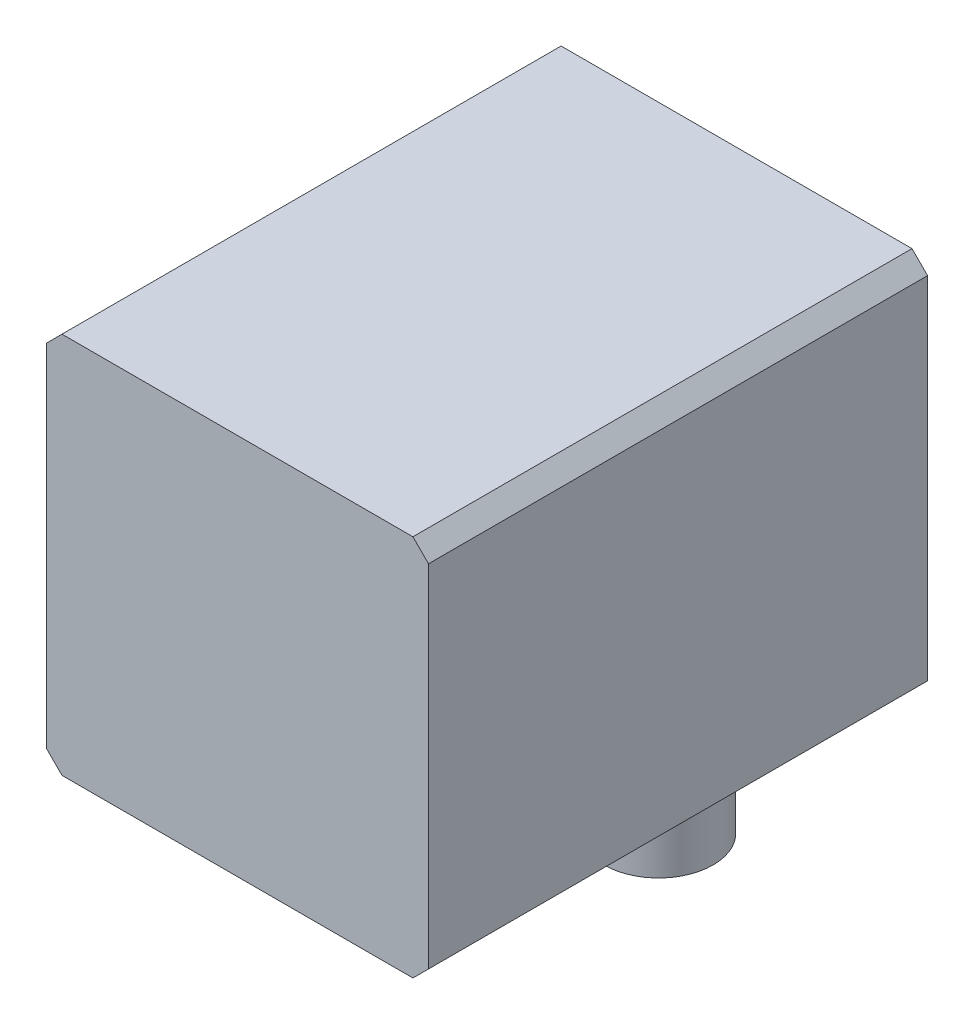
from build123d import *

# Parameters (mm, degrees)
SKETCH_6_W          = 122.5
SKETCH_6_H          = 122.5
EXTRUDE_5_DEPTH     = 160
SKETCH_7_R          = 17.5
EXTRUDE_6_DEPTH     = 55.5
SKETCH_8_R          = 6
EXTRUDE_7_DEPTH     = 5
CHAMFER_1_SIZE      = 5
SKETCH_9_R          = 2.75
CUT_EXTRUDE_1_DEPTH = 20


with BuildPart() as part:
    # 草图6 → 凸台-拉伸5 (new body)
    with BuildSketch(Plane.XY):
        Rectangle(SKETCH_6_W, SKETCH_6_H)
    extrude(amount=EXTRUDE_5_DEPTH)

    # 草图7 → 凸台-拉伸6 (add)
    with BuildSketch(Plane.XZ.offset(61.25)):
        with Locations(Location((0, 25, 0), (0, 0, 90))):
            Circle(SKETCH_7_R)
    extrude(amount=EXTRUDE_6_DEPTH)

    # 草图8 → 凸台-拉伸7 (add)
    with BuildSketch(Plane.XZ.offset(116.75)):
        with Locations(Location((0, 25, 0), (0, 0, 270))):
            Circle(SKETCH_8_R)
    extrude(amount=EXTRUDE_7_DEPTH)

    # 倒角1
    chamfer_1_edges = [part.edges().sort_by_distance(p)[0] for p in [
        (-61.25, 61.25, 80),
        (61.25, 61.25, 80),
        (61.25, -61.25, 80),
        (-61.25, -61.25, 80),
    ]]
    chamfer(chamfer_1_edges, length=CHAMFER_1_SIZE)

    # 草图9 → 切除-拉伸1 (cut)
    with BuildSketch(Plane(origin=(0, 0, 0), x_dir=(-1, 0, 0), z_dir=(0, 0, -1))):
        with Locations((-48, 48)):
            Circle(SKETCH_9_R)
        with Locations((48, 48)):
            Circle(SKETCH_9_R)
        with Locations((48, -48)):
            Circle(SKETCH_9_R)
        with Locations((-48, -48)):
            Circle(SKETCH_9_R)
    extrude(amount=-CUT_EXTRUDE_1_DEPTH, mode=Mode.SUBTRACT)


solid = part.part
